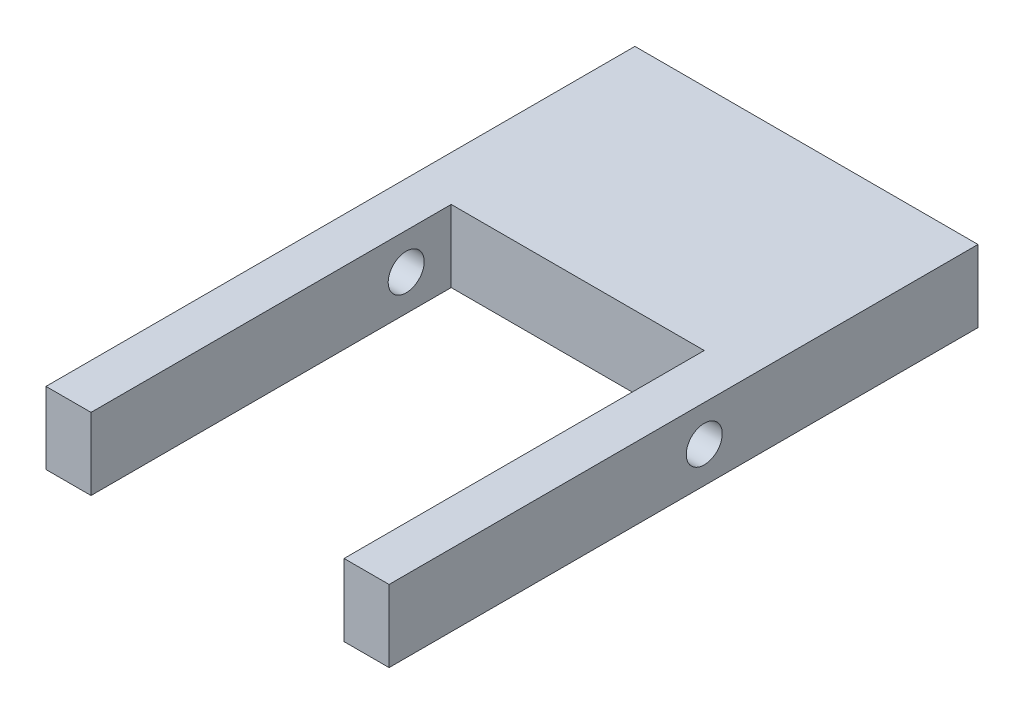
from build123d import *

# Parameters (mm, degrees)
SKETCH1_W           = 38.1
SKETCH1_H           = 25.4
BOSS_EXTRUDE1_DEPTH = 8
SKETCH2_W           = 5
SKETCH2_H           = 8
BOSS_EXTRUDE2_DEPTH = 40
SKETCH3_R           = 2
CUT_EXTRUDE1_DEPTH  = 30
LPATTERN1_COUNT     = 2
LPATTERN1_PITCH     = 33.1


with BuildPart() as part:
    # Sketch1 → Boss-Extrude1 (new body)
    with BuildSketch(Plane(origin=(0, 0, 0), x_dir=(1, 0, 0), z_dir=(0, 1, 0))):
        with Locations((19.05, 12.7)):
            Rectangle(SKETCH1_W, SKETCH1_H)
    extrude(amount=BOSS_EXTRUDE1_DEPTH)

    # Sketch2 → Boss-Extrude2 (add)
    with BuildSketch(Plane.XY):
        with Locations((35.6, 4)):
            Rectangle(SKETCH2_W, SKETCH2_H)
    boss_extrude2 = extrude(amount=BOSS_EXTRUDE2_DEPTH)

    # Sketch3 → Cut-Extrude1 (cut)
    with BuildSketch(Plane.ZY.offset(-33.1)):
        with Locations((5, 4)):
            Circle(SKETCH3_R)
    cut_extrude1 = extrude(amount=-CUT_EXTRUDE1_DEPTH, mode=Mode.SUBTRACT)

    # LPattern1: Boss-Extrude2, Cut-Extrude1 ×2
    with Locations(*[(-i * LPATTERN1_PITCH, 0, 0) for i in range(1, LPATTERN1_COUNT)]):
        add(boss_extrude2)
        add(cut_extrude1, mode=Mode.SUBTRACT)


solid = part.part
